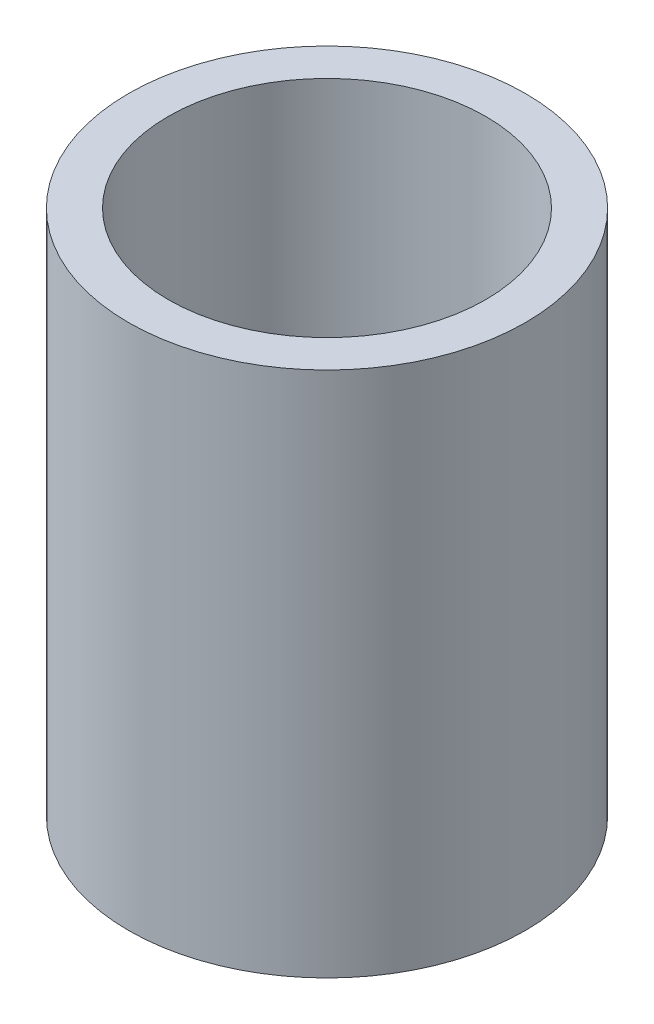
from build123d import *

# Parameters (mm, degrees)
SKETCH1_W = 1.5
SKETCH1_H = 19.9


with BuildPart() as part:
    # Sketch1 → Revolve1 (revolve)
    with BuildSketch(Plane.XY, mode=Mode.PRIVATE) as revolve1_sk:
        with Locations((6.75, 9.95)):
            Rectangle(SKETCH1_W, SKETCH1_H)
    revolve(revolve1_sk.sketch.rotate(Axis((0, 0, 0), (0, 1, 0)), 90), axis=Axis((0, 0, 0), (0, 1, 0)))


solid = part.part
